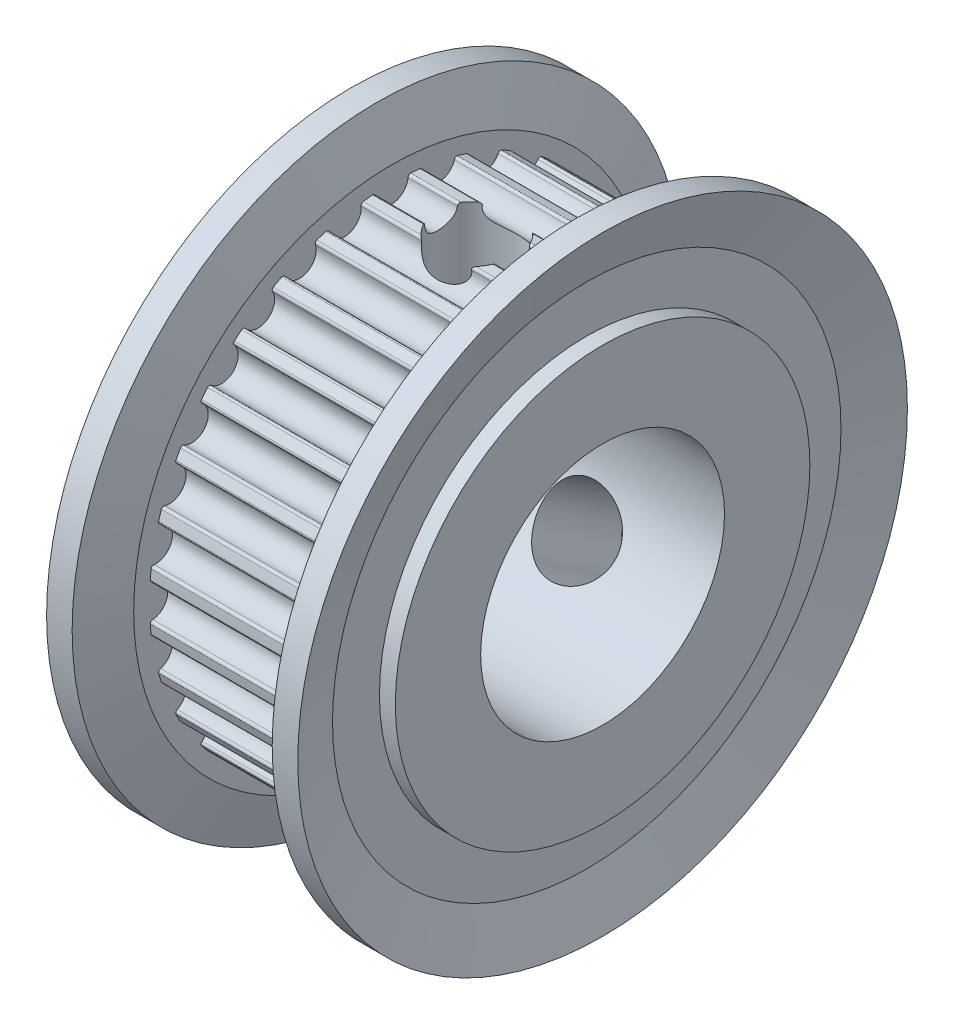
from build123d import *

# Parameters (mm, degrees)
CUT_EXTRUDE1_DEPTH       = 3.5
CUT_EXTRUDE1_DEPTH_BACK  = 3.5
CUT_EXTRUDE2_DEPTH       = 3.5
CUT_EXTRUDE2_DEPTH_BACK  = 3.5
CUT_EXTRUDE3_DEPTH       = 3.5
CUT_EXTRUDE3_DEPTH_BACK  = 3.5
CUT_EXTRUDE4_DEPTH       = 3.5
CUT_EXTRUDE4_DEPTH_BACK  = 3.5
CUT_EXTRUDE5_DEPTH       = 3.5
CUT_EXTRUDE5_DEPTH_BACK  = 3.5
CUT_EXTRUDE6_DEPTH       = 3.5
CUT_EXTRUDE6_DEPTH_BACK  = 3.5
CUT_EXTRUDE7_DEPTH       = 3.5
CUT_EXTRUDE7_DEPTH_BACK  = 3.5
CUT_EXTRUDE8_DEPTH       = 3.5
CUT_EXTRUDE8_DEPTH_BACK  = 3.5
CUT_EXTRUDE9_DEPTH       = 3.5
CUT_EXTRUDE9_DEPTH_BACK  = 3.5
CUT_EXTRUDE10_DEPTH      = 3.5
CUT_EXTRUDE10_DEPTH_BACK = 3.5
CUT_EXTRUDE11_DEPTH      = 3.5
CUT_EXTRUDE11_DEPTH_BACK = 3.5
CUT_EXTRUDE12_DEPTH      = 3.5
CUT_EXTRUDE12_DEPTH_BACK = 3.5
CUT_EXTRUDE13_DEPTH      = 3.5
CUT_EXTRUDE13_DEPTH_BACK = 3.5
CUT_EXTRUDE14_DEPTH      = 3.5
CUT_EXTRUDE14_DEPTH_BACK = 3.5
CUT_EXTRUDE15_DEPTH      = 3.5
CUT_EXTRUDE15_DEPTH_BACK = 3.5
CUT_EXTRUDE16_DEPTH      = 3.5
CUT_EXTRUDE16_DEPTH_BACK = 3.5
CUT_EXTRUDE17_DEPTH      = 3.5
CUT_EXTRUDE17_DEPTH_BACK = 3.5
CUT_EXTRUDE18_DEPTH      = 3.5
CUT_EXTRUDE18_DEPTH_BACK = 3.5
CUT_EXTRUDE19_DEPTH      = 3.5
CUT_EXTRUDE19_DEPTH_BACK = 3.5
CUT_EXTRUDE20_DEPTH      = 3.5
CUT_EXTRUDE20_DEPTH_BACK = 3.5
CUT_EXTRUDE21_DEPTH      = 3.5
CUT_EXTRUDE21_DEPTH_BACK = 3.5
CUT_EXTRUDE22_DEPTH      = 3.5
CUT_EXTRUDE22_DEPTH_BACK = 3.5
CUT_EXTRUDE23_DEPTH      = 3.5
CUT_EXTRUDE23_DEPTH_BACK = 3.5
CUT_EXTRUDE24_DEPTH      = 3.5
CUT_EXTRUDE24_DEPTH_BACK = 3.5
CUT_EXTRUDE25_DEPTH      = 3.5
CUT_EXTRUDE25_DEPTH_BACK = 3.5
CUT_EXTRUDE26_DEPTH      = 3.5
CUT_EXTRUDE26_DEPTH_BACK = 3.5
CUT_EXTRUDE27_DEPTH      = 3.5
CUT_EXTRUDE27_DEPTH_BACK = 3.5
CUT_EXTRUDE28_DEPTH      = 3.5
CUT_EXTRUDE28_DEPTH_BACK = 3.5
CUT_EXTRUDE29_DEPTH      = 3.5
CUT_EXTRUDE29_DEPTH_BACK = 3.5
CUT_EXTRUDE30_DEPTH      = 3.5
CUT_EXTRUDE30_DEPTH_BACK = 3.5
CUT_EXTRUDE31_DEPTH      = 3.5
CUT_EXTRUDE31_DEPTH_BACK = 3.5
CUT_EXTRUDE32_DEPTH      = 3.5
CUT_EXTRUDE32_DEPTH_BACK = 3.5
SKETCH36_W               = 10.3
SKETCH36_H               = 5
SKETCH37_W               = 1.621
SKETCH37_H               = 9.93


with BuildPart() as part:
    # Sketch1 → Revolve1 (revolve)
    with BuildSketch(Plane.XY, mode=Mode.PRIVATE) as revolve1_sk:
        Polygon((-5.15, 0), (-5.15, 8.5), (-3.5, 8.5), (-3.5, 9.93), (3.5, 9.93), (3.5, 8.5), (5.15, 8.5), (5.15, 0), align=None)
    revolve(revolve1_sk.sketch.rotate(Axis((5.15, 0, 0), (-1, 0, 0)), 270), axis=Axis((5.15, 0, 0), (-1, 0, 0)))

    # Sketch2 → Cut-Extrude1 (cut, two sides: drawn at the far end of the back side and taken through both)
    with BuildSketch(Plane(origin=(0, 0, 0), x_dir=(0, 0, -1), z_dir=(1, 0, 0)).offset(-CUT_EXTRUDE1_DEPTH_BACK)):
        with BuildLine():
            Line((-0.950908352, 10.140512724), (-0.927279331, 9.888532197))
            Line((-0.927279331, 9.888532197), (-0.792969158, 9.89929093))
            ThreePointArc((-0.792969158, 9.89929093), (-0.711706778, 9.873169891), (-0.672449407, 9.797375816))
            ThreePointArc((-0.672449407, 9.797375816), (-2e-09, 9.181), (0.672449407, 9.797375812))
            ThreePointArc((0.672449407, 9.797375812), (0.711706777, 9.87316989), (0.792969158, 9.89929093))
            Line((0.792969158, 9.89929093), (0.927279331, 9.888532197))
            Line((0.927279331, 9.888532197), (0.950908352, 10.140512724))
            ThreePointArc((0.950908352, 10.140512724), (0, 10.185), (-0.950908352, 10.140512724))
        make_face()
    extrude(amount=CUT_EXTRUDE1_DEPTH + CUT_EXTRUDE1_DEPTH_BACK, mode=Mode.SUBTRACT)

    # Sketch3 → Cut-Extrude2 (cut, two sides: drawn at the far end of the back side and taken through both)
    with BuildSketch(Plane(origin=(0, 0, 0), x_dir=(0, 0, -1), z_dir=(1, 0, 0)).offset(-CUT_EXTRUDE2_DEPTH_BACK)):
        with BuildLine():
            Line((-2.910952807, 9.760152599), (-2.838618849, 9.5176236))
            Line((-2.838618849, 9.5176236), (-2.708988333, 9.554378222))
            ThreePointArc((-2.708988333, 9.554378222), (-2.624191426, 9.544612596), (-2.570901683, 9.477933616))
            ThreePointArc((-2.570901683, 9.477933616), (-1.791124249, 9.004589659), (-1.251844722, 9.740310354))
            ThreePointArc((-1.251844722, 9.740310354), (-1.228128363, 9.822306803), (-1.153523377, 9.863779439))
            Line((-1.153523377, 9.863779439), (-1.019695012, 9.879430047))
            Line((-1.019695012, 9.879430047), (-1.045678978, 10.131178632))
            ThreePointArc((-1.045678978, 10.131178632), (-1.98699493, 9.989298081), (-2.910952807, 9.760152599))
        make_face()
    extrude(amount=CUT_EXTRUDE2_DEPTH + CUT_EXTRUDE2_DEPTH_BACK, mode=Mode.SUBTRACT)

    # Sketch4 → Cut-Extrude3 (cut, two sides: drawn at the far end of the back side and taken through both)
    with BuildSketch(Plane(origin=(0, 0, 0), x_dir=(0, 0, -1), z_dir=(1, 0, 0)).offset(-CUT_EXTRUDE3_DEPTH_BACK)):
        with BuildLine():
            Line((-4.759130979, 9.004715283), (-4.640871837, 8.780958066))
            Line((-4.640871837, 8.780958066), (-4.520902606, 8.842296117))
            ThreePointArc((-4.520902606, 8.842296117), (-4.435829868, 8.849261191), (-4.370555649, 8.794259742))
            ThreePointArc((-4.370555649, 8.794259742), (-3.513416595, 8.482137987), (-3.12803116, 9.308930232))
            ThreePointArc((-3.12803116, 9.308930232), (-3.120767218, 9.393977974), (-3.055686656, 9.449208436))
            Line((-3.055686656, 9.449208436), (-2.927483047, 9.490666941))
            Line((-2.927483047, 9.490666941), (-3.002081451, 9.732509027))
            ThreePointArc((-3.002081451, 9.732509027), (-3.897630759, 9.409713039), (-4.759130979, 9.004715283))
        make_face()
    extrude(amount=CUT_EXTRUDE3_DEPTH + CUT_EXTRUDE3_DEPTH_BACK, mode=Mode.SUBTRACT)

    # Sketch5 → Cut-Extrude4 (cut, two sides: drawn at the far end of the back side and taken through both)
    with BuildSketch(Plane(origin=(0, 0, 0), x_dir=(0, 0, -1), z_dir=(1, 0, 0)).offset(-CUT_EXTRUDE4_DEPTH_BACK)):
        with BuildLine():
            Line((-6.424418416, 7.903231808), (-6.264778723, 7.706845238))
            Line((-6.264778723, 7.706845238), (-6.159081127, 7.790409532))
            ThreePointArc((-6.159081127, 7.790409532), (-6.077001856, 7.813837641), (-6.002251613, 7.772627398))
            ThreePointArc((-6.002251613, 7.772627398), (-5.100690311, 7.633722509), (-4.884009115, 8.519813141))
            ThreePointArc((-4.884009115, 8.519813141), (-4.893476739, 8.60464384), (-4.84042161, 8.671509651))
            Line((-4.84042161, 8.671509651), (-4.722769551, 8.737182826))
            Line((-4.722769551, 8.737182826), (-4.843115618, 8.959824558))
            ThreePointArc((-4.843115618, 8.959824558), (-5.658482823, 8.468518001), (-6.424418416, 7.903231808))
        make_face()
    extrude(amount=CUT_EXTRUDE4_DEPTH + CUT_EXTRUDE4_DEPTH_BACK, mode=Mode.SUBTRACT)

    # Sketch6 → Cut-Extrude5 (cut, two sides: drawn at the far end of the back side and taken through both)
    with BuildSketch(Plane(origin=(0, 0, 0), x_dir=(0, 0, -1), z_dir=(1, 0, 0)).offset(-CUT_EXTRUDE5_DEPTH_BACK)):
        with BuildLine():
            Line((-7.842819056, 6.498031568), (-7.647933676, 6.33656267))
            Line((-7.647933676, 6.33656267), (-7.560569614, 6.439141876))
            ThreePointArc((-7.560569614, 6.439141876), (-7.484638071, 6.478132693), (-7.403284413, 6.452297342))
            ThreePointArc((-7.403284413, 6.452297342), (-6.49194736, 6.491947357), (-6.452297339, 7.40328441))
            ThreePointArc((-6.452297339, 7.40328441), (-6.478132693, 7.484638069), (-6.439141876, 7.560569614))
            Line((-6.439141876, 7.560569614), (-6.33656267, 7.647933676))
            Line((-6.33656267, 7.647933676), (-6.498031568, 7.842819056))
            ThreePointArc((-6.498031568, 7.842819056), (-7.201882566, 7.201882566), (-7.842819056, 6.498031568))
        make_face()
    extrude(amount=CUT_EXTRUDE5_DEPTH + CUT_EXTRUDE5_DEPTH_BACK, mode=Mode.SUBTRACT)

    # Sketch7 → Cut-Extrude6 (cut, two sides: drawn at the far end of the back side and taken through both)
    with BuildSketch(Plane(origin=(0, 0, 0), x_dir=(0, 0, -1), z_dir=(1, 0, 0)).offset(-CUT_EXTRUDE6_DEPTH_BACK)):
        with BuildLine():
            Line((-8.959824558, 4.843115618), (-8.737182826, 4.722769551))
            Line((-8.737182826, 4.722769551), (-8.671509651, 4.84042161))
            ThreePointArc((-8.671509651, 4.84042161), (-8.604643842, 4.893476738), (-8.519813145, 4.884009117))
            ThreePointArc((-8.519813145, 4.884009117), (-7.633722512, 5.100690308), (-7.772627394, 6.00225161))
            ThreePointArc((-7.772627394, 6.00225161), (-7.813837641, 6.077001854), (-7.790409532, 6.159081127))
            Line((-7.790409532, 6.159081127), (-7.706845238, 6.264778723))
            Line((-7.706845238, 6.264778723), (-7.903231808, 6.424418416))
            ThreePointArc((-7.903231808, 6.424418416), (-8.468518001, 5.658482823), (-8.959824558, 4.843115618))
        make_face()
    extrude(amount=CUT_EXTRUDE6_DEPTH + CUT_EXTRUDE6_DEPTH_BACK, mode=Mode.SUBTRACT)

    # Sketch8 → Cut-Extrude7 (cut, two sides: drawn at the far end of the back side and taken through both)
    with BuildSketch(Plane(origin=(0, 0, 0), x_dir=(0, 0, -1), z_dir=(1, 0, 0)).offset(-CUT_EXTRUDE7_DEPTH_BACK)):
        with BuildLine():
            Line((-9.732509027, 3.002081451), (-9.490666941, 2.927483047))
            Line((-9.490666941, 2.927483047), (-9.449208436, 3.055686656))
            ThreePointArc((-9.449208436, 3.055686656), (-9.393977976, 3.120767217), (-9.308930236, 3.128031162))
            ThreePointArc((-9.308930236, 3.128031162), (-8.482137989, 3.513416591), (-8.794259738, 4.370555647))
            ThreePointArc((-8.794259738, 4.370555647), (-8.84926119, 4.435829866), (-8.842296117, 4.520902606))
            Line((-8.842296117, 4.520902606), (-8.780958066, 4.640871837))
            Line((-8.780958066, 4.640871837), (-9.004715283, 4.759130979))
            ThreePointArc((-9.004715283, 4.759130979), (-9.409713039, 3.897630759), (-9.732509027, 3.002081451))
        make_face()
    extrude(amount=CUT_EXTRUDE7_DEPTH + CUT_EXTRUDE7_DEPTH_BACK, mode=Mode.SUBTRACT)

    # Sketch9 → Cut-Extrude8 (cut, two sides: drawn at the far end of the back side and taken through both)
    with BuildSketch(Plane(origin=(0, 0, 0), x_dir=(0, 0, -1), z_dir=(1, 0, 0)).offset(-CUT_EXTRUDE8_DEPTH_BACK)):
        with BuildLine():
            Line((-10.131178632, 1.045678978), (-9.879430047, 1.019695012))
            Line((-9.879430047, 1.019695012), (-9.863779439, 1.153523377))
            ThreePointArc((-9.863779439, 1.153523377), (-9.822306805, 1.228128361), (-9.740310358, 1.251844723))
            ThreePointArc((-9.740310358, 1.251844723), (-9.00458966, 1.791124244), (-9.477933611, 2.570901682))
            ThreePointArc((-9.477933611, 2.570901682), (-9.544612594, 2.624191424), (-9.554378222, 2.708988333))
            Line((-9.554378222, 2.708988333), (-9.5176236, 2.838618849))
            Line((-9.5176236, 2.838618849), (-9.760152599, 2.910952807))
            ThreePointArc((-9.760152599, 2.910952807), (-9.989298081, 1.98699493), (-10.131178632, 1.045678978))
        make_face()
    extrude(amount=CUT_EXTRUDE8_DEPTH + CUT_EXTRUDE8_DEPTH_BACK, mode=Mode.SUBTRACT)

    # Sketch10 → Cut-Extrude9 (cut, two sides: drawn at the far end of the back side and taken through both)
    with BuildSketch(Plane(origin=(0, 0, 0), x_dir=(0, 0, -1), z_dir=(1, 0, 0)).offset(-CUT_EXTRUDE9_DEPTH_BACK)):
        with BuildLine():
            Line((-10.140512724, -0.950908352), (-9.888532197, -0.927279331))
            Line((-9.888532197, -0.927279331), (-9.89929093, -0.792969158))
            ThreePointArc((-9.89929093, -0.792969158), (-9.873169891, -0.711706778), (-9.797375816, -0.672449407))
            ThreePointArc((-9.797375816, -0.672449407), (-9.181, -2e-09), (-9.797375812, 0.672449407))
            ThreePointArc((-9.797375812, 0.672449407), (-9.87316989, 0.711706777), (-9.89929093, 0.792969158))
            Line((-9.89929093, 0.792969158), (-9.888532197, 0.927279331))
            Line((-9.888532197, 0.927279331), (-10.140512724, 0.950908352))
            ThreePointArc((-10.140512724, 0.950908352), (-10.185, 0), (-10.140512724, -0.950908352))
        make_face()
    extrude(amount=CUT_EXTRUDE9_DEPTH + CUT_EXTRUDE9_DEPTH_BACK, mode=Mode.SUBTRACT)

    # Sketch11 → Cut-Extrude10 (cut, two sides: drawn at the far end of the back side and taken through both)
    with BuildSketch(Plane(origin=(0, 0, 0), x_dir=(0, 0, -1), z_dir=(1, 0, 0)).offset(-CUT_EXTRUDE10_DEPTH_BACK)):
        with BuildLine():
            Line((-9.760152599, -2.910952807), (-9.5176236, -2.838618849))
            Line((-9.5176236, -2.838618849), (-9.554378222, -2.708988333))
            ThreePointArc((-9.554378222, -2.708988333), (-9.544612596, -2.624191426), (-9.477933616, -2.570901683))
            ThreePointArc((-9.477933616, -2.570901683), (-9.004589659, -1.791124249), (-9.740310354, -1.251844722))
            ThreePointArc((-9.740310354, -1.251844722), (-9.822306803, -1.228128363), (-9.863779439, -1.153523377))
            Line((-9.863779439, -1.153523377), (-9.879430047, -1.019695012))
            Line((-9.879430047, -1.019695012), (-10.131178632, -1.045678978))
            ThreePointArc((-10.131178632, -1.045678978), (-9.989298081, -1.98699493), (-9.760152599, -2.910952807))
        make_face()
    extrude(amount=CUT_EXTRUDE10_DEPTH + CUT_EXTRUDE10_DEPTH_BACK, mode=Mode.SUBTRACT)

    # Sketch12 → Cut-Extrude11 (cut, two sides: drawn at the far end of the back side and taken through both)
    with BuildSketch(Plane(origin=(0, 0, 0), x_dir=(0, 0, -1), z_dir=(1, 0, 0)).offset(-CUT_EXTRUDE11_DEPTH_BACK)):
        with BuildLine():
            Line((-9.004715283, -4.759130979), (-8.780958066, -4.640871837))
            Line((-8.780958066, -4.640871837), (-8.842296117, -4.520902606))
            ThreePointArc((-8.842296117, -4.520902606), (-8.849261191, -4.435829868), (-8.794259742, -4.370555649))
            ThreePointArc((-8.794259742, -4.370555649), (-8.482137987, -3.513416595), (-9.308930232, -3.12803116))
            ThreePointArc((-9.308930232, -3.12803116), (-9.393977974, -3.120767218), (-9.449208436, -3.055686656))
            Line((-9.449208436, -3.055686656), (-9.490666941, -2.927483047))
            Line((-9.490666941, -2.927483047), (-9.732509027, -3.002081451))
            ThreePointArc((-9.732509027, -3.002081451), (-9.409713039, -3.897630759), (-9.004715283, -4.759130979))
        make_face()
    extrude(amount=CUT_EXTRUDE11_DEPTH + CUT_EXTRUDE11_DEPTH_BACK, mode=Mode.SUBTRACT)

    # Sketch13 → Cut-Extrude12 (cut, two sides: drawn at the far end of the back side and taken through both)
    with BuildSketch(Plane(origin=(0, 0, 0), x_dir=(0, 0, -1), z_dir=(1, 0, 0)).offset(-CUT_EXTRUDE12_DEPTH_BACK)):
        with BuildLine():
            Line((-7.903231808, -6.424418416), (-7.706845238, -6.264778723))
            Line((-7.706845238, -6.264778723), (-7.790409532, -6.159081127))
            ThreePointArc((-7.790409532, -6.159081127), (-7.813837641, -6.077001856), (-7.772627398, -6.002251613))
            ThreePointArc((-7.772627398, -6.002251613), (-7.633722509, -5.100690311), (-8.519813141, -4.884009115))
            ThreePointArc((-8.519813141, -4.884009115), (-8.60464384, -4.893476739), (-8.671509651, -4.84042161))
            Line((-8.671509651, -4.84042161), (-8.737182826, -4.722769551))
            Line((-8.737182826, -4.722769551), (-8.959824558, -4.843115618))
            ThreePointArc((-8.959824558, -4.843115618), (-8.468518001, -5.658482823), (-7.903231808, -6.424418416))
        make_face()
    extrude(amount=CUT_EXTRUDE12_DEPTH + CUT_EXTRUDE12_DEPTH_BACK, mode=Mode.SUBTRACT)

    # Sketch14 → Cut-Extrude13 (cut, two sides: drawn at the far end of the back side and taken through both)
    with BuildSketch(Plane(origin=(0, 0, 0), x_dir=(0, 0, -1), z_dir=(1, 0, 0)).offset(-CUT_EXTRUDE13_DEPTH_BACK)):
        with BuildLine():
            Line((-6.498031568, -7.842819056), (-6.33656267, -7.647933676))
            Line((-6.33656267, -7.647933676), (-6.439141876, -7.560569614))
            ThreePointArc((-6.439141876, -7.560569614), (-6.478132693, -7.484638071), (-6.452297342, -7.403284413))
            ThreePointArc((-6.452297342, -7.403284413), (-6.491947357, -6.49194736), (-7.40328441, -6.452297339))
            ThreePointArc((-7.40328441, -6.452297339), (-7.484638069, -6.478132693), (-7.560569614, -6.439141876))
            Line((-7.560569614, -6.439141876), (-7.647933676, -6.33656267))
            Line((-7.647933676, -6.33656267), (-7.842819056, -6.498031568))
            ThreePointArc((-7.842819056, -6.498031568), (-7.201882566, -7.201882566), (-6.498031568, -7.842819056))
        make_face()
    extrude(amount=CUT_EXTRUDE13_DEPTH + CUT_EXTRUDE13_DEPTH_BACK, mode=Mode.SUBTRACT)

    # Sketch15 → Cut-Extrude14 (cut, two sides: drawn at the far end of the back side and taken through both)
    with BuildSketch(Plane(origin=(0, 0, 0), x_dir=(0, 0, -1), z_dir=(1, 0, 0)).offset(-CUT_EXTRUDE14_DEPTH_BACK)):
        with BuildLine():
            Line((-4.843115618, -8.959824558), (-4.722769551, -8.737182826))
            Line((-4.722769551, -8.737182826), (-4.84042161, -8.671509651))
            ThreePointArc((-4.84042161, -8.671509651), (-4.893476738, -8.604643842), (-4.884009117, -8.519813145))
            ThreePointArc((-4.884009117, -8.519813145), (-5.100690308, -7.633722512), (-6.00225161, -7.772627394))
            ThreePointArc((-6.00225161, -7.772627394), (-6.077001854, -7.813837641), (-6.159081127, -7.790409532))
            Line((-6.159081127, -7.790409532), (-6.264778723, -7.706845238))
            Line((-6.264778723, -7.706845238), (-6.424418416, -7.903231808))
            ThreePointArc((-6.424418416, -7.903231808), (-5.658482823, -8.468518001), (-4.843115618, -8.959824558))
        make_face()
    extrude(amount=CUT_EXTRUDE14_DEPTH + CUT_EXTRUDE14_DEPTH_BACK, mode=Mode.SUBTRACT)

    # Sketch16 → Cut-Extrude15 (cut, two sides: drawn at the far end of the back side and taken through both)
    with BuildSketch(Plane(origin=(0, 0, 0), x_dir=(0, 0, -1), z_dir=(1, 0, 0)).offset(-CUT_EXTRUDE15_DEPTH_BACK)):
        with BuildLine():
            Line((-3.002081451, -9.732509027), (-2.927483047, -9.490666941))
            Line((-2.927483047, -9.490666941), (-3.055686656, -9.449208436))
            ThreePointArc((-3.055686656, -9.449208436), (-3.120767217, -9.393977976), (-3.128031162, -9.308930236))
            ThreePointArc((-3.128031162, -9.308930236), (-3.513416591, -8.482137989), (-4.370555647, -8.794259738))
            ThreePointArc((-4.370555647, -8.794259738), (-4.435829866, -8.84926119), (-4.520902606, -8.842296117))
            Line((-4.520902606, -8.842296117), (-4.640871837, -8.780958066))
            Line((-4.640871837, -8.780958066), (-4.759130979, -9.004715283))
            ThreePointArc((-4.759130979, -9.004715283), (-3.897630759, -9.409713039), (-3.002081451, -9.732509027))
        make_face()
    extrude(amount=CUT_EXTRUDE15_DEPTH + CUT_EXTRUDE15_DEPTH_BACK, mode=Mode.SUBTRACT)

    # Sketch17 → Cut-Extrude16 (cut, two sides: drawn at the far end of the back side and taken through both)
    with BuildSketch(Plane(origin=(0, 0, 0), x_dir=(0, 0, -1), z_dir=(1, 0, 0)).offset(-CUT_EXTRUDE16_DEPTH_BACK)):
        with BuildLine():
            Line((-1.045678978, -10.131178632), (-1.019695012, -9.879430047))
            Line((-1.019695012, -9.879430047), (-1.153523377, -9.863779439))
            ThreePointArc((-1.153523377, -9.863779439), (-1.228128361, -9.822306805), (-1.251844723, -9.740310358))
            ThreePointArc((-1.251844723, -9.740310358), (-1.791124244, -9.00458966), (-2.570901682, -9.477933611))
            ThreePointArc((-2.570901682, -9.477933611), (-2.624191424, -9.544612594), (-2.708988333, -9.554378222))
            Line((-2.708988333, -9.554378222), (-2.838618849, -9.5176236))
            Line((-2.838618849, -9.5176236), (-2.910952807, -9.760152599))
            ThreePointArc((-2.910952807, -9.760152599), (-1.98699493, -9.989298081), (-1.045678978, -10.131178632))
        make_face()
    extrude(amount=CUT_EXTRUDE16_DEPTH + CUT_EXTRUDE16_DEPTH_BACK, mode=Mode.SUBTRACT)

    # Sketch18 → Cut-Extrude17 (cut, two sides: drawn at the far end of the back side and taken through both)
    with BuildSketch(Plane(origin=(0, 0, 0), x_dir=(0, 0, -1), z_dir=(1, 0, 0)).offset(-CUT_EXTRUDE17_DEPTH_BACK)):
        with BuildLine():
            Line((0.950908352, -10.140512724), (0.927279331, -9.888532197))
            Line((0.927279331, -9.888532197), (0.792969158, -9.89929093))
            ThreePointArc((0.792969158, -9.89929093), (0.711706778, -9.873169891), (0.672449407, -9.797375816))
            ThreePointArc((0.672449407, -9.797375816), (2e-09, -9.181), (-0.672449407, -9.797375812))
            ThreePointArc((-0.672449407, -9.797375812), (-0.711706777, -9.87316989), (-0.792969158, -9.89929093))
            Line((-0.792969158, -9.89929093), (-0.927279331, -9.888532197))
            Line((-0.927279331, -9.888532197), (-0.950908352, -10.140512724))
            ThreePointArc((-0.950908352, -10.140512724), (0, -10.185), (0.950908352, -10.140512724))
        make_face()
    extrude(amount=CUT_EXTRUDE17_DEPTH + CUT_EXTRUDE17_DEPTH_BACK, mode=Mode.SUBTRACT)

    # Sketch19 → Cut-Extrude18 (cut, two sides: drawn at the far end of the back side and taken through both)
    with BuildSketch(Plane(origin=(0, 0, 0), x_dir=(0, 0, -1), z_dir=(1, 0, 0)).offset(-CUT_EXTRUDE18_DEPTH_BACK)):
        with BuildLine():
            Line((2.910952807, -9.760152599), (2.838618849, -9.5176236))
            Line((2.838618849, -9.5176236), (2.708988333, -9.554378222))
            ThreePointArc((2.708988333, -9.554378222), (2.624191426, -9.544612596), (2.570901683, -9.477933616))
            ThreePointArc((2.570901683, -9.477933616), (1.791124249, -9.004589659), (1.251844722, -9.740310354))
            ThreePointArc((1.251844722, -9.740310354), (1.228128363, -9.822306803), (1.153523377, -9.863779439))
            Line((1.153523377, -9.863779439), (1.019695012, -9.879430047))
            Line((1.019695012, -9.879430047), (1.045678978, -10.131178632))
            ThreePointArc((1.045678978, -10.131178632), (1.98699493, -9.989298081), (2.910952807, -9.760152599))
        make_face()
    extrude(amount=CUT_EXTRUDE18_DEPTH + CUT_EXTRUDE18_DEPTH_BACK, mode=Mode.SUBTRACT)

    # Sketch20 → Cut-Extrude19 (cut, two sides: drawn at the far end of the back side and taken through both)
    with BuildSketch(Plane(origin=(0, 0, 0), x_dir=(0, 0, -1), z_dir=(1, 0, 0)).offset(-CUT_EXTRUDE19_DEPTH_BACK)):
        with BuildLine():
            Line((4.759130979, -9.004715283), (4.640871837, -8.780958066))
            Line((4.640871837, -8.780958066), (4.520902606, -8.842296117))
            ThreePointArc((4.520902606, -8.842296117), (4.435829868, -8.849261191), (4.370555649, -8.794259742))
            ThreePointArc((4.370555649, -8.794259742), (3.513416595, -8.482137987), (3.12803116, -9.308930232))
            ThreePointArc((3.12803116, -9.308930232), (3.120767218, -9.393977974), (3.055686656, -9.449208436))
            Line((3.055686656, -9.449208436), (2.927483047, -9.490666941))
            Line((2.927483047, -9.490666941), (3.002081451, -9.732509027))
            ThreePointArc((3.002081451, -9.732509027), (3.897630759, -9.409713039), (4.759130979, -9.004715283))
        make_face()
    extrude(amount=CUT_EXTRUDE19_DEPTH + CUT_EXTRUDE19_DEPTH_BACK, mode=Mode.SUBTRACT)

    # Sketch21 → Cut-Extrude20 (cut, two sides: drawn at the far end of the back side and taken through both)
    with BuildSketch(Plane(origin=(0, 0, 0), x_dir=(0, 0, -1), z_dir=(1, 0, 0)).offset(-CUT_EXTRUDE20_DEPTH_BACK)):
        with BuildLine():
            Line((6.424418416, -7.903231808), (6.264778723, -7.706845238))
            Line((6.264778723, -7.706845238), (6.159081127, -7.790409532))
            ThreePointArc((6.159081127, -7.790409532), (6.077001856, -7.813837641), (6.002251613, -7.772627398))
            ThreePointArc((6.002251613, -7.772627398), (5.100690311, -7.633722509), (4.884009115, -8.519813141))
            ThreePointArc((4.884009115, -8.519813141), (4.893476739, -8.60464384), (4.84042161, -8.671509651))
            Line((4.84042161, -8.671509651), (4.722769551, -8.737182826))
            Line((4.722769551, -8.737182826), (4.843115618, -8.959824558))
            ThreePointArc((4.843115618, -8.959824558), (5.658482823, -8.468518001), (6.424418416, -7.903231808))
        make_face()
    extrude(amount=CUT_EXTRUDE20_DEPTH + CUT_EXTRUDE20_DEPTH_BACK, mode=Mode.SUBTRACT)

    # Sketch22 → Cut-Extrude21 (cut, two sides: drawn at the far end of the back side and taken through both)
    with BuildSketch(Plane(origin=(0, 0, 0), x_dir=(0, 0, -1), z_dir=(1, 0, 0)).offset(-CUT_EXTRUDE21_DEPTH_BACK)):
        with BuildLine():
            Line((7.842819056, -6.498031568), (7.647933676, -6.33656267))
            Line((7.647933676, -6.33656267), (7.560569614, -6.439141876))
            ThreePointArc((7.560569614, -6.439141876), (7.484638071, -6.478132693), (7.403284413, -6.452297342))
            ThreePointArc((7.403284413, -6.452297342), (6.49194736, -6.491947357), (6.452297339, -7.40328441))
            ThreePointArc((6.452297339, -7.40328441), (6.478132693, -7.484638069), (6.439141876, -7.560569614))
            Line((6.439141876, -7.560569614), (6.33656267, -7.647933676))
            Line((6.33656267, -7.647933676), (6.498031568, -7.842819056))
            ThreePointArc((6.498031568, -7.842819056), (7.201882566, -7.201882566), (7.842819056, -6.498031568))
        make_face()
    extrude(amount=CUT_EXTRUDE21_DEPTH + CUT_EXTRUDE21_DEPTH_BACK, mode=Mode.SUBTRACT)

    # Sketch23 → Cut-Extrude22 (cut, two sides: drawn at the far end of the back side and taken through both)
    with BuildSketch(Plane(origin=(0, 0, 0), x_dir=(0, 0, -1), z_dir=(1, 0, 0)).offset(-CUT_EXTRUDE22_DEPTH_BACK)):
        with BuildLine():
            Line((8.959824558, -4.843115618), (8.737182826, -4.722769551))
            Line((8.737182826, -4.722769551), (8.671509651, -4.84042161))
            ThreePointArc((8.671509651, -4.84042161), (8.604643842, -4.893476738), (8.519813145, -4.884009117))
            ThreePointArc((8.519813145, -4.884009117), (7.633722512, -5.100690308), (7.772627394, -6.00225161))
            ThreePointArc((7.772627394, -6.00225161), (7.813837641, -6.077001854), (7.790409532, -6.159081127))
            Line((7.790409532, -6.159081127), (7.706845238, -6.264778723))
            Line((7.706845238, -6.264778723), (7.903231808, -6.424418416))
            ThreePointArc((7.903231808, -6.424418416), (8.468518001, -5.658482823), (8.959824558, -4.843115618))
        make_face()
    extrude(amount=CUT_EXTRUDE22_DEPTH + CUT_EXTRUDE22_DEPTH_BACK, mode=Mode.SUBTRACT)

    # Sketch24 → Cut-Extrude23 (cut, two sides: drawn at the far end of the back side and taken through both)
    with BuildSketch(Plane(origin=(0, 0, 0), x_dir=(0, 0, -1), z_dir=(1, 0, 0)).offset(-CUT_EXTRUDE23_DEPTH_BACK)):
        with BuildLine():
            Line((9.732509027, -3.002081451), (9.490666941, -2.927483047))
            Line((9.490666941, -2.927483047), (9.449208436, -3.055686656))
            ThreePointArc((9.449208436, -3.055686656), (9.393977976, -3.120767217), (9.308930236, -3.128031162))
            ThreePointArc((9.308930236, -3.128031162), (8.482137989, -3.513416591), (8.794259738, -4.370555647))
            ThreePointArc((8.794259738, -4.370555647), (8.84926119, -4.435829866), (8.842296117, -4.520902606))
            Line((8.842296117, -4.520902606), (8.780958066, -4.640871837))
            Line((8.780958066, -4.640871837), (9.004715283, -4.759130979))
            ThreePointArc((9.004715283, -4.759130979), (9.409713039, -3.897630759), (9.732509027, -3.002081451))
        make_face()
    extrude(amount=CUT_EXTRUDE23_DEPTH + CUT_EXTRUDE23_DEPTH_BACK, mode=Mode.SUBTRACT)

    # Sketch25 → Cut-Extrude24 (cut, two sides: drawn at the far end of the back side and taken through both)
    with BuildSketch(Plane(origin=(0, 0, 0), x_dir=(0, 0, -1), z_dir=(1, 0, 0)).offset(-CUT_EXTRUDE24_DEPTH_BACK)):
        with BuildLine():
            Line((10.131178632, -1.045678978), (9.879430047, -1.019695012))
            Line((9.879430047, -1.019695012), (9.863779439, -1.153523377))
            ThreePointArc((9.863779439, -1.153523377), (9.822306805, -1.228128361), (9.740310358, -1.251844723))
            ThreePointArc((9.740310358, -1.251844723), (9.00458966, -1.791124244), (9.477933611, -2.570901682))
            ThreePointArc((9.477933611, -2.570901682), (9.544612594, -2.624191424), (9.554378222, -2.708988333))
            Line((9.554378222, -2.708988333), (9.5176236, -2.838618849))
            Line((9.5176236, -2.838618849), (9.760152599, -2.910952807))
            ThreePointArc((9.760152599, -2.910952807), (9.989298081, -1.98699493), (10.131178632, -1.045678978))
        make_face()
    extrude(amount=CUT_EXTRUDE24_DEPTH + CUT_EXTRUDE24_DEPTH_BACK, mode=Mode.SUBTRACT)

    # Sketch26 → Cut-Extrude25 (cut, two sides: drawn at the far end of the back side and taken through both)
    with BuildSketch(Plane(origin=(0, 0, 0), x_dir=(0, 0, -1), z_dir=(1, 0, 0)).offset(-CUT_EXTRUDE25_DEPTH_BACK)):
        with BuildLine():
            Line((10.140512724, 0.950908352), (9.888532197, 0.927279331))
            Line((9.888532197, 0.927279331), (9.89929093, 0.792969158))
            ThreePointArc((9.89929093, 0.792969158), (9.873169891, 0.711706778), (9.797375816, 0.672449407))
            ThreePointArc((9.797375816, 0.672449407), (9.181, 2e-09), (9.797375812, -0.672449407))
            ThreePointArc((9.797375812, -0.672449407), (9.87316989, -0.711706777), (9.89929093, -0.792969158))
            Line((9.89929093, -0.792969158), (9.888532197, -0.927279331))
            Line((9.888532197, -0.927279331), (10.140512724, -0.950908352))
            ThreePointArc((10.140512724, -0.950908352), (10.185, 0), (10.140512724, 0.950908352))
        make_face()
    extrude(amount=CUT_EXTRUDE25_DEPTH + CUT_EXTRUDE25_DEPTH_BACK, mode=Mode.SUBTRACT)

    # Sketch27 → Cut-Extrude26 (cut, two sides: drawn at the far end of the back side and taken through both)
    with BuildSketch(Plane(origin=(0, 0, 0), x_dir=(0, 0, -1), z_dir=(1, 0, 0)).offset(-CUT_EXTRUDE26_DEPTH_BACK)):
        with BuildLine():
            Line((9.760152599, 2.910952807), (9.5176236, 2.838618849))
            Line((9.5176236, 2.838618849), (9.554378222, 2.708988333))
            ThreePointArc((9.554378222, 2.708988333), (9.544612596, 2.624191426), (9.477933616, 2.570901683))
            ThreePointArc((9.477933616, 2.570901683), (9.004589659, 1.791124249), (9.740310354, 1.251844722))
            ThreePointArc((9.740310354, 1.251844722), (9.822306803, 1.228128363), (9.863779439, 1.153523377))
            Line((9.863779439, 1.153523377), (9.879430047, 1.019695012))
            Line((9.879430047, 1.019695012), (10.131178632, 1.045678978))
            ThreePointArc((10.131178632, 1.045678978), (9.989298081, 1.98699493), (9.760152599, 2.910952807))
        make_face()
    extrude(amount=CUT_EXTRUDE26_DEPTH + CUT_EXTRUDE26_DEPTH_BACK, mode=Mode.SUBTRACT)

    # Sketch28 → Cut-Extrude27 (cut, two sides: drawn at the far end of the back side and taken through both)
    with BuildSketch(Plane(origin=(0, 0, 0), x_dir=(0, 0, -1), z_dir=(1, 0, 0)).offset(-CUT_EXTRUDE27_DEPTH_BACK)):
        with BuildLine():
            Line((9.004715283, 4.759130979), (8.780958066, 4.640871837))
            Line((8.780958066, 4.640871837), (8.842296117, 4.520902606))
            ThreePointArc((8.842296117, 4.520902606), (8.849261191, 4.435829868), (8.794259742, 4.370555649))
            ThreePointArc((8.794259742, 4.370555649), (8.482137987, 3.513416595), (9.308930232, 3.12803116))
            ThreePointArc((9.308930232, 3.12803116), (9.393977974, 3.120767218), (9.449208436, 3.055686656))
            Line((9.449208436, 3.055686656), (9.490666941, 2.927483047))
            Line((9.490666941, 2.927483047), (9.732509027, 3.002081451))
            ThreePointArc((9.732509027, 3.002081451), (9.409713039, 3.897630759), (9.004715283, 4.759130979))
        make_face()
    extrude(amount=CUT_EXTRUDE27_DEPTH + CUT_EXTRUDE27_DEPTH_BACK, mode=Mode.SUBTRACT)

    # Sketch29 → Cut-Extrude28 (cut, two sides: drawn at the far end of the back side and taken through both)
    with BuildSketch(Plane(origin=(0, 0, 0), x_dir=(0, 0, -1), z_dir=(1, 0, 0)).offset(-CUT_EXTRUDE28_DEPTH_BACK)):
        with BuildLine():
            Line((7.903231808, 6.424418416), (7.706845238, 6.264778723))
            Line((7.706845238, 6.264778723), (7.790409532, 6.159081127))
            ThreePointArc((7.790409532, 6.159081127), (7.813837641, 6.077001856), (7.772627398, 6.002251613))
            ThreePointArc((7.772627398, 6.002251613), (7.633722509, 5.100690311), (8.519813141, 4.884009115))
            ThreePointArc((8.519813141, 4.884009115), (8.60464384, 4.893476739), (8.671509651, 4.84042161))
            Line((8.671509651, 4.84042161), (8.737182826, 4.722769551))
            Line((8.737182826, 4.722769551), (8.959824558, 4.843115618))
            ThreePointArc((8.959824558, 4.843115618), (8.468518001, 5.658482823), (7.903231808, 6.424418416))
        make_face()
    extrude(amount=CUT_EXTRUDE28_DEPTH + CUT_EXTRUDE28_DEPTH_BACK, mode=Mode.SUBTRACT)

    # Sketch30 → Cut-Extrude29 (cut, two sides: drawn at the far end of the back side and taken through both)
    with BuildSketch(Plane(origin=(0, 0, 0), x_dir=(0, 0, -1), z_dir=(1, 0, 0)).offset(-CUT_EXTRUDE29_DEPTH_BACK)):
        with BuildLine():
            Line((6.498031568, 7.842819056), (6.33656267, 7.647933676))
            Line((6.33656267, 7.647933676), (6.439141876, 7.560569614))
            ThreePointArc((6.439141876, 7.560569614), (6.478132693, 7.484638071), (6.452297342, 7.403284413))
            ThreePointArc((6.452297342, 7.403284413), (6.491947357, 6.49194736), (7.40328441, 6.452297339))
            ThreePointArc((7.40328441, 6.452297339), (7.484638069, 6.478132693), (7.560569614, 6.439141876))
            Line((7.560569614, 6.439141876), (7.647933676, 6.33656267))
            Line((7.647933676, 6.33656267), (7.842819056, 6.498031568))
            ThreePointArc((7.842819056, 6.498031568), (7.201882566, 7.201882566), (6.498031568, 7.842819056))
        make_face()
    extrude(amount=CUT_EXTRUDE29_DEPTH + CUT_EXTRUDE29_DEPTH_BACK, mode=Mode.SUBTRACT)

    # Sketch31 → Cut-Extrude30 (cut, two sides: drawn at the far end of the back side and taken through both)
    with BuildSketch(Plane(origin=(0, 0, 0), x_dir=(0, 0, -1), z_dir=(1, 0, 0)).offset(-CUT_EXTRUDE30_DEPTH_BACK)):
        with BuildLine():
            Line((4.843115618, 8.959824558), (4.722769551, 8.737182826))
            Line((4.722769551, 8.737182826), (4.84042161, 8.671509651))
            ThreePointArc((4.84042161, 8.671509651), (4.893476738, 8.604643842), (4.884009117, 8.519813145))
            ThreePointArc((4.884009117, 8.519813145), (5.100690308, 7.633722512), (6.00225161, 7.772627394))
            ThreePointArc((6.00225161, 7.772627394), (6.077001854, 7.813837641), (6.159081127, 7.790409532))
            Line((6.159081127, 7.790409532), (6.264778723, 7.706845238))
            Line((6.264778723, 7.706845238), (6.424418416, 7.903231808))
            ThreePointArc((6.424418416, 7.903231808), (5.658482823, 8.468518001), (4.843115618, 8.959824558))
        make_face()
    extrude(amount=CUT_EXTRUDE30_DEPTH + CUT_EXTRUDE30_DEPTH_BACK, mode=Mode.SUBTRACT)

    # Sketch32 → Cut-Extrude31 (cut, two sides: drawn at the far end of the back side and taken through both)
    with BuildSketch(Plane(origin=(0, 0, 0), x_dir=(0, 0, -1), z_dir=(1, 0, 0)).offset(-CUT_EXTRUDE31_DEPTH_BACK)):
        with BuildLine():
            Line((3.002081451, 9.732509027), (2.927483047, 9.490666941))
            Line((2.927483047, 9.490666941), (3.055686656, 9.449208436))
            ThreePointArc((3.055686656, 9.449208436), (3.120767217, 9.393977976), (3.128031162, 9.308930236))
            ThreePointArc((3.128031162, 9.308930236), (3.513416591, 8.482137989), (4.370555647, 8.794259738))
            ThreePointArc((4.370555647, 8.794259738), (4.435829866, 8.84926119), (4.520902606, 8.842296117))
            Line((4.520902606, 8.842296117), (4.640871837, 8.780958066))
            Line((4.640871837, 8.780958066), (4.759130979, 9.004715283))
            ThreePointArc((4.759130979, 9.004715283), (3.897630759, 9.409713039), (3.002081451, 9.732509027))
        make_face()
    extrude(amount=CUT_EXTRUDE31_DEPTH + CUT_EXTRUDE31_DEPTH_BACK, mode=Mode.SUBTRACT)

    # Sketch33 → Cut-Extrude32 (cut, two sides: drawn at the far end of the back side and taken through both)
    with BuildSketch(Plane(origin=(0, 0, 0), x_dir=(0, 0, -1), z_dir=(1, 0, 0)).offset(-CUT_EXTRUDE32_DEPTH_BACK)):
        with BuildLine():
            Line((1.045678978, 10.131178632), (1.019695012, 9.879430047))
            Line((1.019695012, 9.879430047), (1.153523377, 9.863779439))
            ThreePointArc((1.153523377, 9.863779439), (1.228128361, 9.822306805), (1.251844723, 9.740310358))
            ThreePointArc((1.251844723, 9.740310358), (1.791124244, 9.00458966), (2.570901682, 9.477933611))
            ThreePointArc((2.570901682, 9.477933611), (2.624191424, 9.544612594), (2.708988333, 9.554378222))
            Line((2.708988333, 9.554378222), (2.838618849, 9.5176236))
            Line((2.838618849, 9.5176236), (2.910952807, 9.760152599))
            ThreePointArc((2.910952807, 9.760152599), (1.98699493, 9.989298081), (1.045678978, 10.131178632))
        make_face()
    extrude(amount=CUT_EXTRUDE32_DEPTH + CUT_EXTRUDE32_DEPTH_BACK, mode=Mode.SUBTRACT)

    # Sketch34 → Revolve2 (revolve)
    with BuildSketch(Plane.XY, mode=Mode.PRIVATE) as revolve2_sk:
        Polygon((3.5, 8.5), (4.5, 8.5), (4.5, 10.425), (5.15, 12.5), (4.102084235, 12.5), (3.5, 10.577961864), align=None)
    revolve(revolve2_sk.sketch.rotate(Axis((50, 0, 0), (-1, 0, 0)), 270), axis=Axis((50, 0, 0), (-1, 0, 0)))

    # Sketch35 → Revolve3 (revolve)
    with BuildSketch(Plane.XY, mode=Mode.PRIVATE) as revolve3_sk:
        Polygon((-5.15, 12.5), (-4.5, 10.425), (-4.5, 8.5), (-3.5, 8.5), (-3.5, 10.577961864), (-4.102084235, 12.5), align=None)
    revolve(revolve3_sk.sketch.rotate(Axis((50, 0, 0), (-1, 0, 0)), 270), axis=Axis((50, 0, 0), (-1, 0, 0)))

    # Sketch36 → Cut-Revolve1 (revolve, cut)
    with BuildSketch(Plane.XY, mode=Mode.PRIVATE) as cut_revolve1_sk:
        with Locations((0, 2.5)):
            Rectangle(SKETCH36_W, SKETCH36_H)
    revolve(cut_revolve1_sk.sketch.rotate(Axis((5.15, 0, 0), (-1, 0, 0)), 270), axis=Axis((5.15, 0, 0), (-1, 0, 0)), mode=Mode.SUBTRACT)

    # Sketch37 → Cut-Revolve2 (revolve, cut)
    with BuildSketch(Plane(origin=(0, 0, 0), x_dir=(0, 0, -1), z_dir=(1, 0, 0)), mode=Mode.PRIVATE) as cut_revolve2_sk:
        with Locations((0.8105, 4.965)):
            Rectangle(SKETCH37_W, SKETCH37_H)
    revolve(cut_revolve2_sk.sketch.rotate(Axis((0, 0, 0), (0, 1, 0)), 180), axis=Axis((0, 0, 0), (0, 1, 0)), mode=Mode.SUBTRACT)

    # Sketch38 → Cut-Revolve3 (revolve, cut)
    with BuildSketch(Plane(origin=(0, 0, 0), x_dir=(0, 0, -1), z_dir=(1, 0, 0)), mode=Mode.PRIVATE) as cut_revolve3_sk:
        Polygon((8.25649325, -5.516812414), (7.355913902, -6.864624655), (-0.900579348, -1.347812242), (0, 0), align=None)
    revolve(cut_revolve3_sk.sketch.rotate(Axis((0, 0, 0), (0, -0.5555702330196052, -0.8314696123025433)), 180), axis=Axis((0, 0, 0), (0, -0.5555702330196052, -0.8314696123025433)), mode=Mode.SUBTRACT)


solid = part.part
